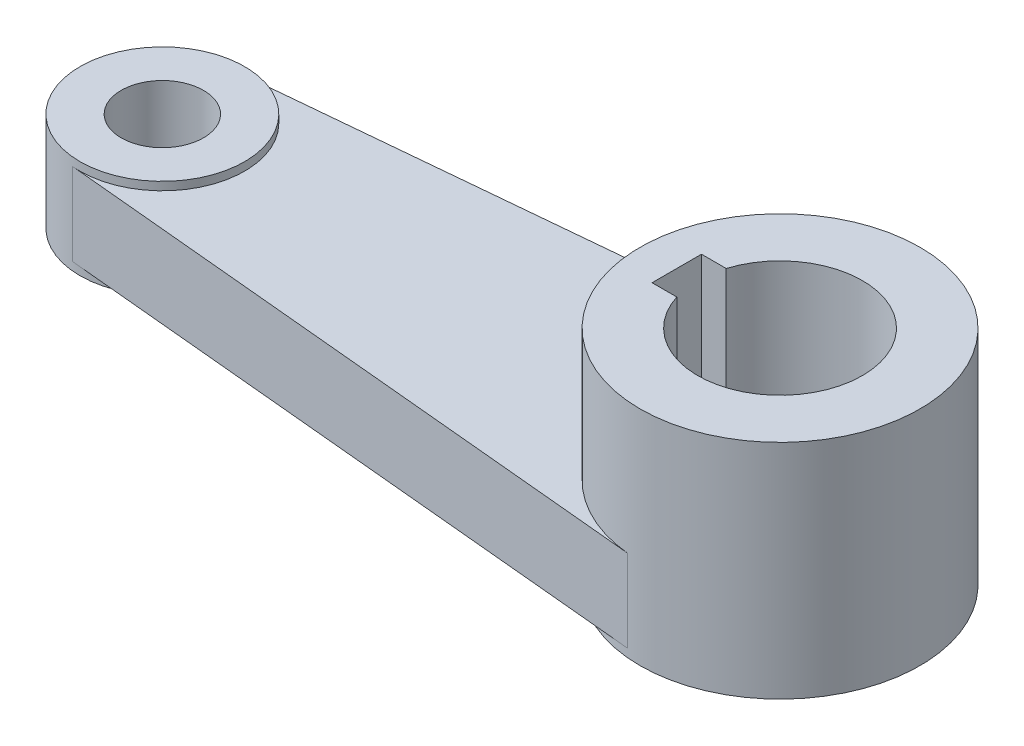
from build123d import *

# Parameters (mm, degrees)
SCHIZZO1_R                        = 10
SCHIZZO1_R_2                      = 5
ESTRUSIONE_ESTRUSIONE1_DEPTH      = 6
ESTRUSIONE_ESTRUSIONE2_DEPTH      = 5
ESTRUSIONE_ESTRUSIONE3_DEPTH      = 21
ESTRUSIONE_ESTRUSIONE3_DEPTH_BACK = 6
SCHIZZO1_4_R                      = 17


with BuildPart() as part:
    # Schizzo1 → Estrusione-Estrusione1 (new, symmetric)
    with BuildSketch(Plane(origin=(0, 0, 0), x_dir=(1, 0, 0), z_dir=(0, 1, 0))):
        with Locations((-78.089397902, 0)):
            Circle(SCHIZZO1_R)
        with Locations((-78.089397902, 0)):
            Circle(SCHIZZO1_R_2, mode=Mode.SUBTRACT)
    extrude(amount=ESTRUSIONE_ESTRUSIONE1_DEPTH, both=True)

    # Schizzo1<3> → Estrusione-Estrusione2 (add, symmetric)
    with BuildSketch(Plane(origin=(0, 0, 0), x_dir=(1, 0, 0), z_dir=(0, 1, 0))):
        with BuildLine():
            ThreePointArc((-79.022731235, 9.956349175), (-68.089397902, 0), (-79.022731235, -9.956349175))
            Line((-79.022731235, -9.956349175), (-4.676064568, -16.925793597))
            ThreePointArc((-4.676064568, -16.925793597), (-20.089397902, 0), (-4.676064568, 16.925793597))
            Line((-4.676064568, 16.925793597), (-79.022731235, 9.956349175))
        make_face()
    extrude(amount=ESTRUSIONE_ESTRUSIONE2_DEPTH, both=True)

    # Schizzo1<4> → Estrusione-Estrusione3 (add, two sides: drawn at the far end of the back side and taken through both)
    with BuildSketch(Plane(origin=(0, 0, 0), x_dir=(1, 0, 0), z_dir=(0, 1, 0)).offset(-ESTRUSIONE_ESTRUSIONE3_DEPTH_BACK)):
        with Locations((-3.089397902, 0)):
            Circle(SCHIZZO1_4_R)
        with BuildLine():
            ThreePointArc((-12.628789916, 3), (6.910602098, 0), (-12.628789916, -3))
            Line((-12.628789916, -3), (-15.628789916, -3))
            Line((-15.628789916, -3), (-15.628789916, 3))
            Line((-15.628789916, 3), (-12.628789916, 3))
        make_face(mode=Mode.SUBTRACT)
    extrude(amount=ESTRUSIONE_ESTRUSIONE3_DEPTH + ESTRUSIONE_ESTRUSIONE3_DEPTH_BACK)


solid = part.part
